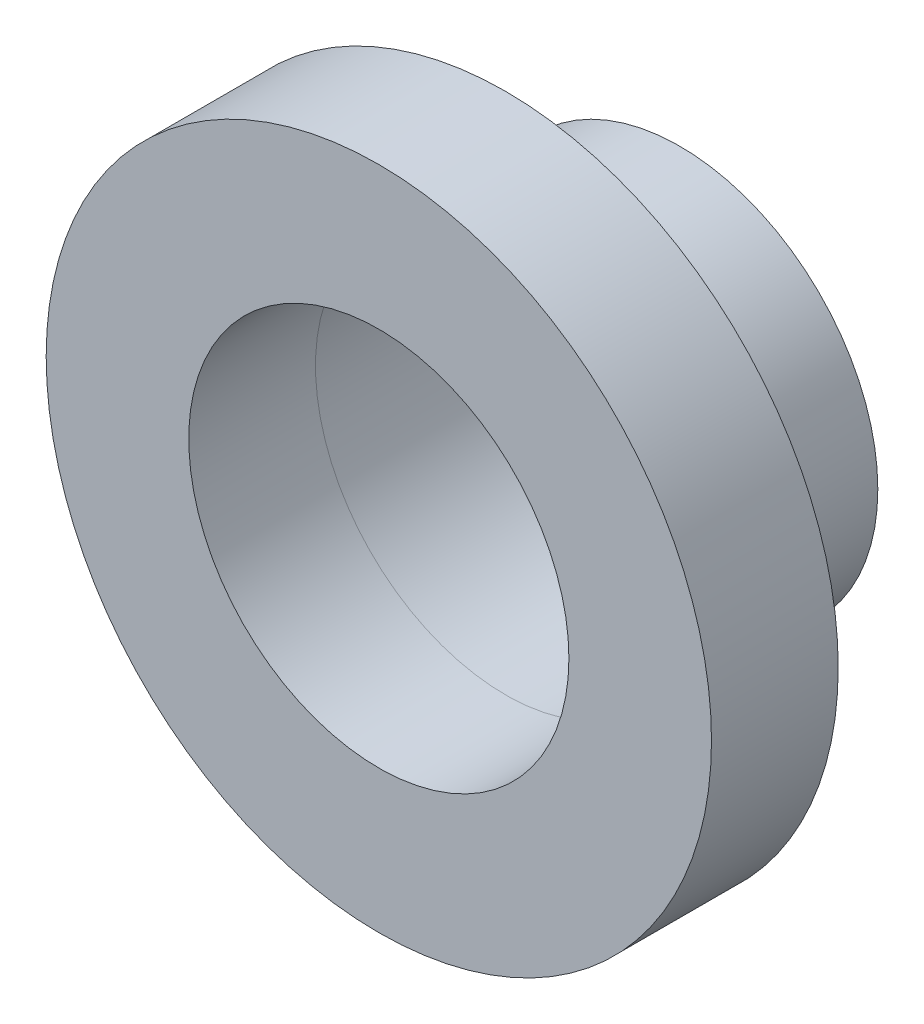
from build123d import *

# Parameters (mm, degrees)
SKETCH_2_R      = 12.5
SKETCH_2_R_2    = 12
EXTRUDE_1_DEPTH = 11
SKETCH_3_R      = 21
SKETCH_3_R_2    = 12
EXTRUDE_2_DEPTH = 8


with BuildPart() as part:
    # 草图2 → 凸台-拉伸1 (new body)
    with BuildSketch(Plane.XY):
        Circle(SKETCH_2_R)
        Circle(SKETCH_2_R_2, mode=Mode.SUBTRACT)
    extrude(amount=EXTRUDE_1_DEPTH)


with BuildPart() as body_2:
    # 草图3 → 凸台-拉伸2 (new body)
    with BuildSketch(Plane.XY.offset(11)):
        Circle(SKETCH_3_R)
        Circle(SKETCH_3_R_2, mode=Mode.SUBTRACT)
    extrude(amount=EXTRUDE_2_DEPTH)


solid = Compound([part.part, body_2.part])
